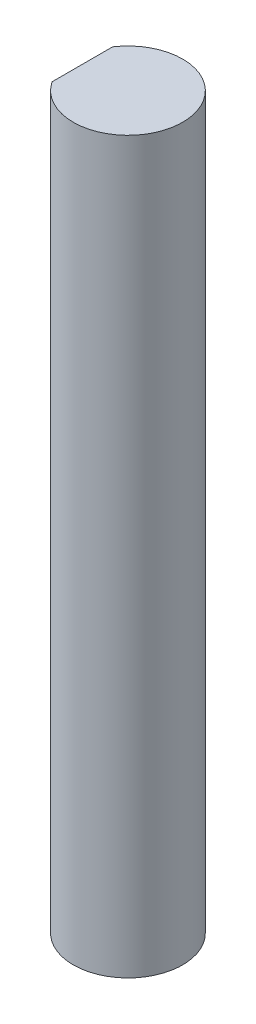
from build123d import *

# Parameters (mm, degrees)
BOSS_EXTRUDE1_DEPTH = 40


with BuildPart() as part:
    # Sketch1 → Boss-Extrude1 (new body)
    with BuildSketch(Plane(origin=(0, 0, 0), x_dir=(1, 0, 0), z_dir=(0, 1, 0))):
        with BuildLine():
            Line((-2.5, 1.658312395), (-2.5, -1.658312395))
            ThreePointArc((-2.5, -1.658312395), (3, 0), (-2.5, 1.658312395))
        make_face()
    extrude(amount=BOSS_EXTRUDE1_DEPTH)


solid = part.part
